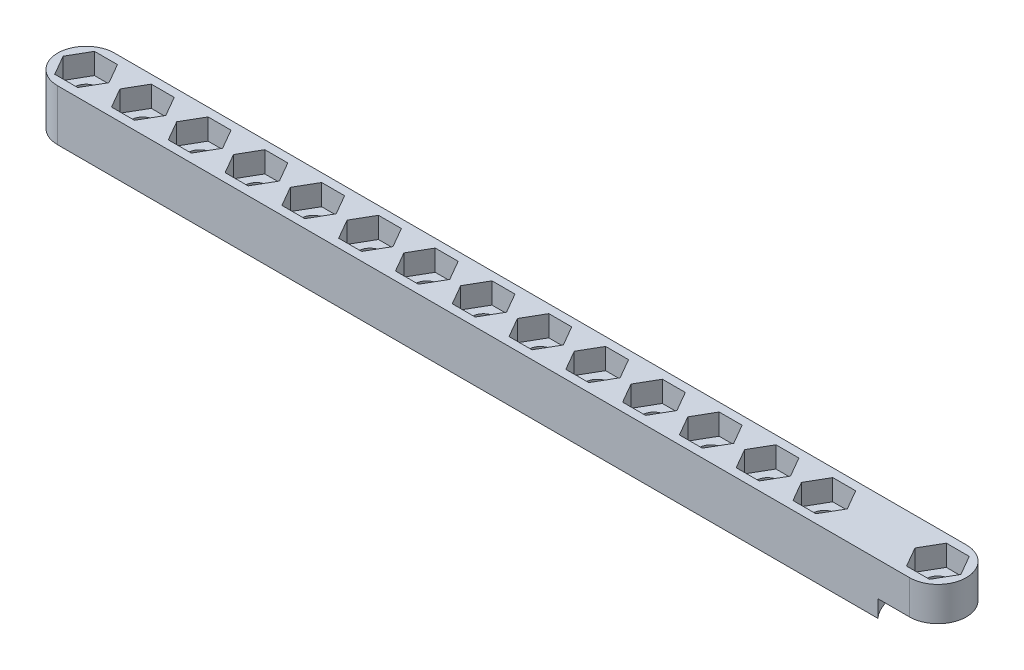
from build123d import *

# Parameters (mm, degrees)
SKETCH1_R           = 2.05
BOSS_EXTRUDE1_DEPTH = 6
CUT_EXTRUDE1_DEPTH  = 3.7
BOSS_EXTRUDE2_START = 3
BOSS_EXTRUDE2_DEPTH = 3
SKETCH5_R           = 2.05
CUT_EXTRUDE2_DEPTH  = 156.341559153


with BuildPart() as part:
    # Sketch1 → Boss-Extrude1 (new body)
    with BuildSketch(Plane(origin=(0, 0, 0), x_dir=(1, 0, 0), z_dir=(0, 1, 0))):
        with BuildLine():
            Line((0, -5), (-150, -5))
            ThreePointArc((-150, -5), (-155, 0), (-150, 5))
            Line((-150, 5), (0, 5))
            ThreePointArc((0, 5), (5, 0), (0, -5))
        make_face()
        with Locations(Location((0, 0, 0), (0, 0, 270))):
            Circle(SKETCH1_R, mode=Mode.SUBTRACT)
        with Locations(Location((-50, 0, 0), (0, 0, 270))):
            Circle(SKETCH1_R, mode=Mode.SUBTRACT)
        with Locations(Location((-60, 0, 0), (0, 0, 270))):
            Circle(SKETCH1_R, mode=Mode.SUBTRACT)
        with Locations(Location((-70, 0, 0), (0, 0, 270))):
            Circle(SKETCH1_R, mode=Mode.SUBTRACT)
        with Locations(Location((-80, 0, 0), (0, 0, 270))):
            Circle(SKETCH1_R, mode=Mode.SUBTRACT)
        with Locations(Location((-90, 0, 0), (0, 0, 270))):
            Circle(SKETCH1_R, mode=Mode.SUBTRACT)
        with Locations(Location((-100, 0, 0), (0, 0, 270))):
            Circle(SKETCH1_R, mode=Mode.SUBTRACT)
        with Locations(Location((-110, 0, 0), (0, 0, 270))):
            Circle(SKETCH1_R, mode=Mode.SUBTRACT)
        with Locations(Location((-120, 0, 0), (0, 0, 270))):
            Circle(SKETCH1_R, mode=Mode.SUBTRACT)
        with Locations(Location((-130, 0, 0), (0, 0, 270))):
            Circle(SKETCH1_R, mode=Mode.SUBTRACT)
        with Locations(Location((-140, 0, 0), (0, 0, 270))):
            Circle(SKETCH1_R, mode=Mode.SUBTRACT)
        with Locations(Location((-150, 0, 0), (0, 0, 270))):
            Circle(SKETCH1_R, mode=Mode.SUBTRACT)
        with Locations(Location((-20, 0, 0), (0, 0, 270))):
            Circle(SKETCH1_R, mode=Mode.SUBTRACT)
        with Locations(Location((-30, 0, 0), (0, 0, 270))):
            Circle(SKETCH1_R, mode=Mode.SUBTRACT)
        with Locations(Location((-40, 0, 0), (0, 0, 270))):
            Circle(SKETCH1_R, mode=Mode.SUBTRACT)
    extrude(amount=BOSS_EXTRUDE1_DEPTH)

    # Sketch2 → Cut-Extrude1 (cut)
    with BuildSketch(Plane(origin=(0, 6, 0), x_dir=(1, 0, 0), z_dir=(0, 1, 0))):
        Polygon((4.041451884, 0), (2.020725942, 3.5), (-2.020725942, 3.5), (-4.041451884, 0), (-2.020725942, -3.5), (2.020725942, -3.5), align=None)
        Polygon((-45.958548116, 0), (-47.979274058, 3.5), (-52.020725942, 3.5), (-54.041451884, 0), (-52.020725942, -3.5), (-47.979274058, -3.5), align=None)
        Polygon((-55.958548116, 0), (-57.979274058, 3.5), (-62.020725942, 3.5), (-64.041451884, 0), (-62.020725942, -3.5), (-57.979274058, -3.5), align=None)
        Polygon((-65.958548116, 0), (-67.979274058, 3.5), (-72.020725942, 3.5), (-74.041451884, 0), (-72.020725942, -3.5), (-67.979274058, -3.5), align=None)
        Polygon((-75.958548116, 0), (-77.979274058, 3.5), (-82.020725942, 3.5), (-84.041451884, 0), (-82.020725942, -3.5), (-77.979274058, -3.5), align=None)
        Polygon((-85.958548116, 0), (-87.979274058, 3.5), (-92.020725942, 3.5), (-94.041451884, 0), (-92.020725942, -3.5), (-87.979274058, -3.5), align=None)
        Polygon((-95.958548116, 0), (-97.979274058, 3.5), (-102.020725942, 3.5), (-104.041451884, 0), (-102.020725942, -3.5), (-97.979274058, -3.5), align=None)
        Polygon((-105.958548116, 0), (-107.979274058, 3.5), (-112.020725942, 3.5), (-114.041451884, 0), (-112.020725942, -3.5), (-107.979274058, -3.5), align=None)
        Polygon((-115.958548116, 0), (-117.979274058, 3.5), (-122.020725942, 3.5), (-124.041451884, 0), (-122.020725942, -3.5), (-117.979274058, -3.5), align=None)
        Polygon((-125.958548116, 0), (-127.979274058, 3.5), (-132.020725942, 3.5), (-134.041451884, 0), (-132.020725942, -3.5), (-127.979274058, -3.5), align=None)
        Polygon((-135.958548116, 0), (-137.979274058, 3.5), (-142.020725942, 3.5), (-144.041451884, 0), (-142.020725942, -3.5), (-137.979274058, -3.5), align=None)
        Polygon((-145.958548116, 0), (-147.979274058, 3.5), (-152.020725942, 3.5), (-154.041451884, 0), (-152.020725942, -3.5), (-147.979274058, -3.5), align=None)
        Polygon((-15.958548116, 0), (-17.979274058, 3.5), (-22.020725942, 3.5), (-24.041451884, 0), (-22.020725942, -3.5), (-17.979274058, -3.5), align=None)
        Polygon((-25.958548116, 0), (-27.979274058, 3.5), (-32.020725942, 3.5), (-34.041451884, 0), (-32.020725942, -3.5), (-27.979274058, -3.5), align=None)
        Polygon((-35.958548116, 0), (-37.979274058, 3.5), (-42.020725942, 3.5), (-44.041451884, 0), (-42.020725942, -3.5), (-37.979274058, -3.5), align=None)
    extrude(amount=-CUT_EXTRUDE1_DEPTH, mode=Mode.SUBTRACT)

    # Sketch4 → Boss-Extrude2 (add)
    with BuildSketch(Plane.XZ.offset(BOSS_EXTRUDE2_START)):
        with BuildLine():
            Line((-150, 5), (-5.577689938, 5))
            ThreePointArc((-5.577689938, 5), (-7.490702573, 0), (-5.577689938, -5))
            Line((-5.577689938, -5), (-150, -5))
            ThreePointArc((-150, -5), (-155, 0), (-150, 5))
        make_face()
    extrude(amount=-BOSS_EXTRUDE2_DEPTH)

    # Sketch5 → Cut-Extrude2 (cut, through all)
    with BuildSketch(Plane.XZ.offset(3)):
        with Locations(Location((-50, 0, 0), (0, 0, 270))):
            Circle(SKETCH5_R)
        with Locations(Location((-60, 0, 0), (0, 0, 270))):
            Circle(SKETCH5_R)
        with Locations(Location((-70, 0, 0), (0, 0, 270))):
            Circle(SKETCH5_R)
        with Locations(Location((-80, 0, 0), (0, 0, 270))):
            Circle(SKETCH5_R)
        with Locations(Location((-90, 0, 0), (0, 0, 270))):
            Circle(SKETCH5_R)
        with Locations(Location((-100, 0, 0), (0, 0, 270))):
            Circle(SKETCH5_R)
        with Locations(Location((-110, 0, 0), (0, 0, 270))):
            Circle(SKETCH5_R)
        with Locations(Location((-120, 0, 0), (0, 0, 270))):
            Circle(SKETCH5_R)
        with Locations(Location((-130, 0, 0), (0, 0, 270))):
            Circle(SKETCH5_R)
        with Locations(Location((-140, 0, 0), (0, 0, 270))):
            Circle(SKETCH5_R)
        with Locations(Location((-150, 0, 0), (0, 0, 270))):
            Circle(SKETCH5_R)
        with Locations(Location((-40, 0, 0), (0, 0, 270))):
            Circle(SKETCH5_R)
        with Locations(Location((-30, 0, 0), (0, 0, 270))):
            Circle(SKETCH5_R)
        with Locations(Location((-20, 0, 0), (0, 0, 270))):
            Circle(SKETCH5_R)
    extrude(amount=-CUT_EXTRUDE2_DEPTH, mode=Mode.SUBTRACT)


solid = part.part
